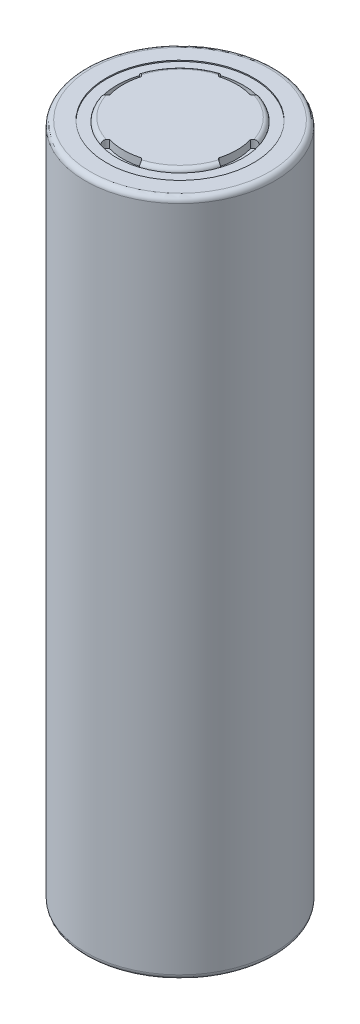
from build123d import *

# Parameters (mm, degrees)
ESBO_O1_R                = 9
RESSALTO_EXTRUS_O1_DEPTH = 64.5
ESBO_O3_R                = 7
CORTE_EXTRUS_O1_DEPTH    = 0.5
ESBO_O4_R                = 7
RESSALTO_EXTRUS_O2_DEPTH = 0.75
FILETE2_R                = 0.5
CORTE_EXTRUS_O2_START    = -0.5
ESBO_O5_R                = 7
CORTE_EXTRUS_O2_DEPTH    = 0.5
ESBO_O6_R                = 7
ESBO_O6_R_2              = 6
RESSALTO_EXTRUS_O3_DEPTH = 0.4
ESBO_O7_R                = 6
RESSALTO_EXTRUS_O4_DEPTH = 0.75
FILETE3_R                = 0.4
FILETE4_R                = 0.5
CORTE_EXTRUS_O3_DEPTH    = 0.75


with BuildPart() as part:
    # Esboço1 → Ressalto-extrusão1 (new body)
    with BuildSketch(Plane(origin=(0, 0, 0), x_dir=(1, 0, 0), z_dir=(0, 1, 0))):
        with Locations(Location((0, 0, 0), (0, 0, 270))):
            Circle(ESBO_O1_R)
    extrude(amount=RESSALTO_EXTRUS_O1_DEPTH)

    # Esboço3 → Corte-extrusão1 (cut)
    with BuildSketch(Plane.XZ):
        with Locations(Location((0, 0, 0), (0, 0, 270))):
            Circle(ESBO_O3_R)
    extrude(amount=-CORTE_EXTRUS_O1_DEPTH, mode=Mode.SUBTRACT)

    # Esboço5 → Corte-extrusão2 (cut)
    with BuildSketch(Plane(origin=(0, 64.5, 0), x_dir=(1, 0, 0), z_dir=(0, 1, 0)).offset(CORTE_EXTRUS_O2_START)):
        with Locations(Location((0, 0, 0), (0, 0, 90))):
            Circle(ESBO_O5_R)
    extrude(amount=CORTE_EXTRUS_O2_DEPTH, mode=Mode.SUBTRACT)

    # Filete4
    filete4_edges = [part.edges().sort_by_distance(p)[0] for p in [
        (0, 0, -9),
        (0, 64.5, -9),
    ]]
    fillet(filete4_edges, radius=FILETE4_R)


with BuildPart() as body_2:
    # Esboço4 → Ressalto-extrusão2 (new body)
    with BuildSketch(Plane.XZ.offset(-0.5)):
        with Locations(Location((0, 0, 0), (0, 0, 270))):
            Circle(ESBO_O4_R)
    extrude(amount=RESSALTO_EXTRUS_O2_DEPTH)

    # Filete2
    filete2_edges = [body_2.edges().sort_by_distance(p)[0] for p in [
        (0, -0.25, 7),
    ]]
    fillet(filete2_edges, radius=FILETE2_R)


with BuildPart() as body_3:
    # Esboço6 → Ressalto-extrusão3 (new body)
    with BuildSketch(Plane(origin=(0, 64, 0), x_dir=(1, 0, 0), z_dir=(0, 1, 0))):
        with Locations(Location((0, 0, 0), (0, 0, 90))):
            Circle(ESBO_O6_R)
        with Locations(Location((0, 0, 0), (0, 0, 90))):
            Circle(ESBO_O6_R_2, mode=Mode.SUBTRACT)
    extrude(amount=RESSALTO_EXTRUS_O3_DEPTH)


with BuildPart() as body_4:
    # Esboço7 → Ressalto-extrusão4 (new body)
    with BuildSketch(Plane(origin=(0, 64, 0), x_dir=(1, 0, 0), z_dir=(0, 1, 0))):
        with Locations(Location((0, 0, 0), (0, 0, 270))):
            Circle(ESBO_O7_R)
    extrude(amount=RESSALTO_EXTRUS_O4_DEPTH)

    # Filete3
    filete3_edges = [body_4.edges().sort_by_distance(p)[0] for p in [
        (0, 64.75, -6),
    ]]
    fillet(filete3_edges, radius=FILETE3_R)

    # Esboço8 → Corte-extrusão3 (cut)
    with BuildSketch(Plane(origin=(0, 64.75, 0), x_dir=(1, 0, 0), z_dir=(0, 1, 0))):
        with BuildLine():
            ThreePointArc((-1.8352967, 5.712415078), (-1.729170633, 5.411457188), (-1.502590953, 5.186735045))
            ThreePointArc((-1.502590953, 5.186735045), (0, 5.4), (1.502590953, 5.186735045))
            ThreePointArc((1.502590953, 5.186735045), (1.729170633, 5.411457188), (1.8352967, 5.712415078))
            ThreePointArc((1.8352967, 5.712415078), (0, 6), (-1.8352967, 5.712415078))
        make_face()
        with BuildLine():
            ThreePointArc((5.712415078, -1.8352967), (5.411457188, -1.729170633), (5.186735045, -1.502590953))
            ThreePointArc((5.186735045, -1.502590953), (5.4, 0), (5.186735045, 1.502590953))
            ThreePointArc((5.186735045, 1.502590953), (5.411457188, 1.729170633), (5.712415078, 1.8352967))
            ThreePointArc((5.712415078, 1.8352967), (6, 0), (5.712415078, -1.8352967))
        make_face()
        with BuildLine():
            ThreePointArc((-1.8352967, -5.712415078), (-1.729170633, -5.411457188), (-1.502590953, -5.186735045))
            ThreePointArc((-1.502590953, -5.186735045), (0, -5.4), (1.502590953, -5.186735045))
            ThreePointArc((1.502590953, -5.186735045), (1.729170633, -5.411457188), (1.8352967, -5.712415078))
            ThreePointArc((1.8352967, -5.712415078), (0, -6), (-1.8352967, -5.712415078))
        make_face()
        with BuildLine():
            ThreePointArc((-5.712415078, 1.8352967), (-5.411457188, 1.729170633), (-5.186735045, 1.502590953))
            ThreePointArc((-5.186735045, 1.502590953), (-5.4, 0), (-5.186735045, -1.502590953))
            ThreePointArc((-5.186735045, -1.502590953), (-5.411457188, -1.729170633), (-5.712415078, -1.8352967))
            ThreePointArc((-5.712415078, -1.8352967), (-6, 0), (-5.712415078, 1.8352967))
        make_face()
    extrude(amount=-CORTE_EXTRUS_O3_DEPTH, mode=Mode.SUBTRACT)


solid = Compound([part.part, body_2.part, body_3.part, body_4.part])
